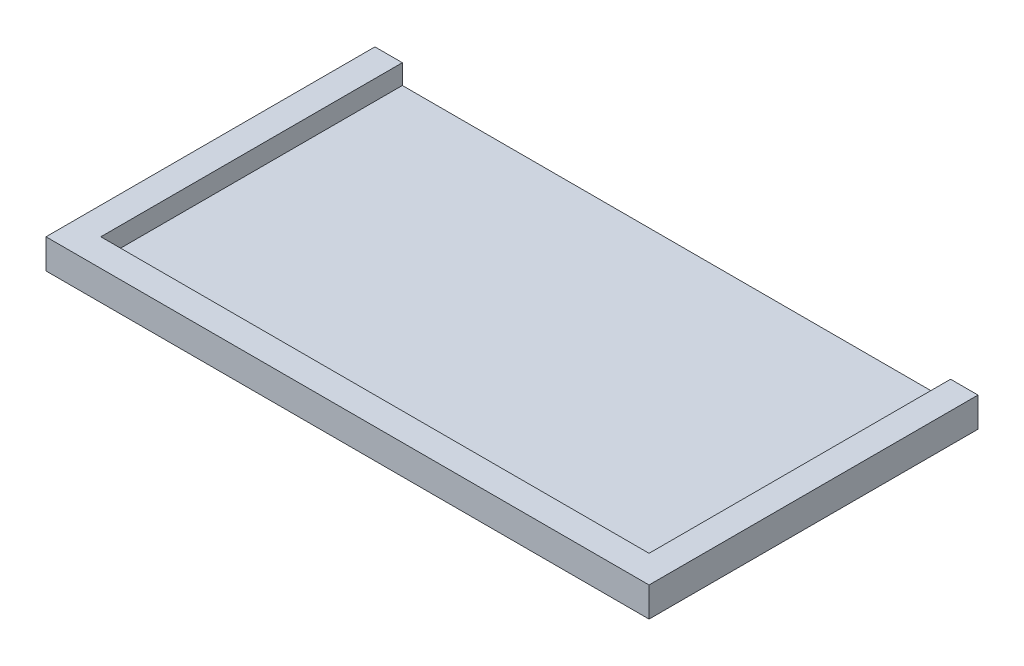
from build123d import *

# Parameters (mm, degrees)
SKETCH1_W           = 55
SKETCH1_H           = 30
BOSS_EXTRUDE1_DEPTH = 0.9
BOSS_EXTRUDE2_DEPTH = 1.8


with BuildPart() as part:
    # Sketch1 → Boss-Extrude1 (new body)
    with BuildSketch(Plane(origin=(0, 0, 0), x_dir=(1, 0, 0), z_dir=(0, 1, 0))):
        Rectangle(SKETCH1_W, SKETCH1_H)
    extrude(amount=BOSS_EXTRUDE1_DEPTH)

    # Sketch2 → Boss-Extrude2 (add)
    with BuildSketch(Plane(origin=(0, 0.9, 0), x_dir=(1, 0, 0), z_dir=(0, 1, 0))):
        Polygon((27.5, -15), (27.5, 15), (25, 15), (25, -12.5), (-25, -12.5), (-25, 15), (-27.5, 15), (-27.5, -15), align=None)
    extrude(amount=BOSS_EXTRUDE2_DEPTH)


solid = part.part
